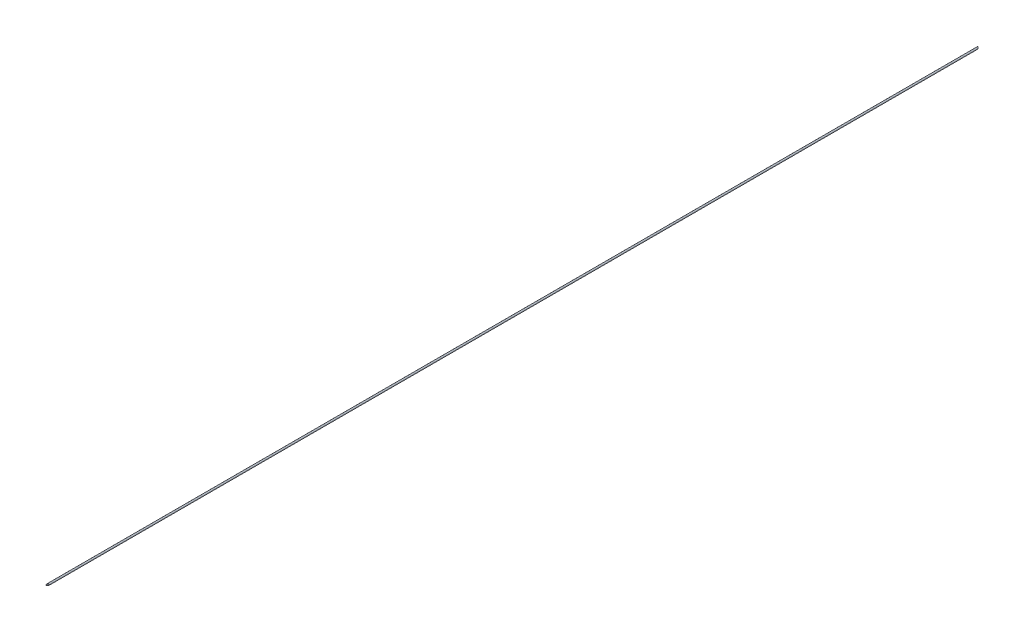
from build123d import *

# Parameters (mm, degrees)
ESBO_O1_R                = 5
RESSALTO_EXTRUS_O1_DEPTH = 2780
CORTE_EXTRUS_O1_DEPTH    = 5


with BuildPart() as part:
    # Esboço1 → Ressalto-extrusão1 (new, symmetric)
    with BuildSketch(Plane.XY):
        Circle(ESBO_O1_R)
    extrude(amount=RESSALTO_EXTRUS_O1_DEPTH, both=True)

    # Esboço2 → Corte-extrusão1 (cut, symmetric)
    with BuildSketch(Plane(origin=(0, 0, 0), x_dir=(1, 0, 0), z_dir=(0, 1, 0))):
        Polygon((-5, -2780), (5, -2780), (5, -2770), align=None)
    corte_extrus_o1 = extrude(amount=CORTE_EXTRUS_O1_DEPTH, both=True, mode=Mode.SUBTRACT)

    # Espelhar1: Corte-extrusão1 across plane
    add(corte_extrus_o1.mirror(Plane.XY), mode=Mode.SUBTRACT)


solid = part.part
